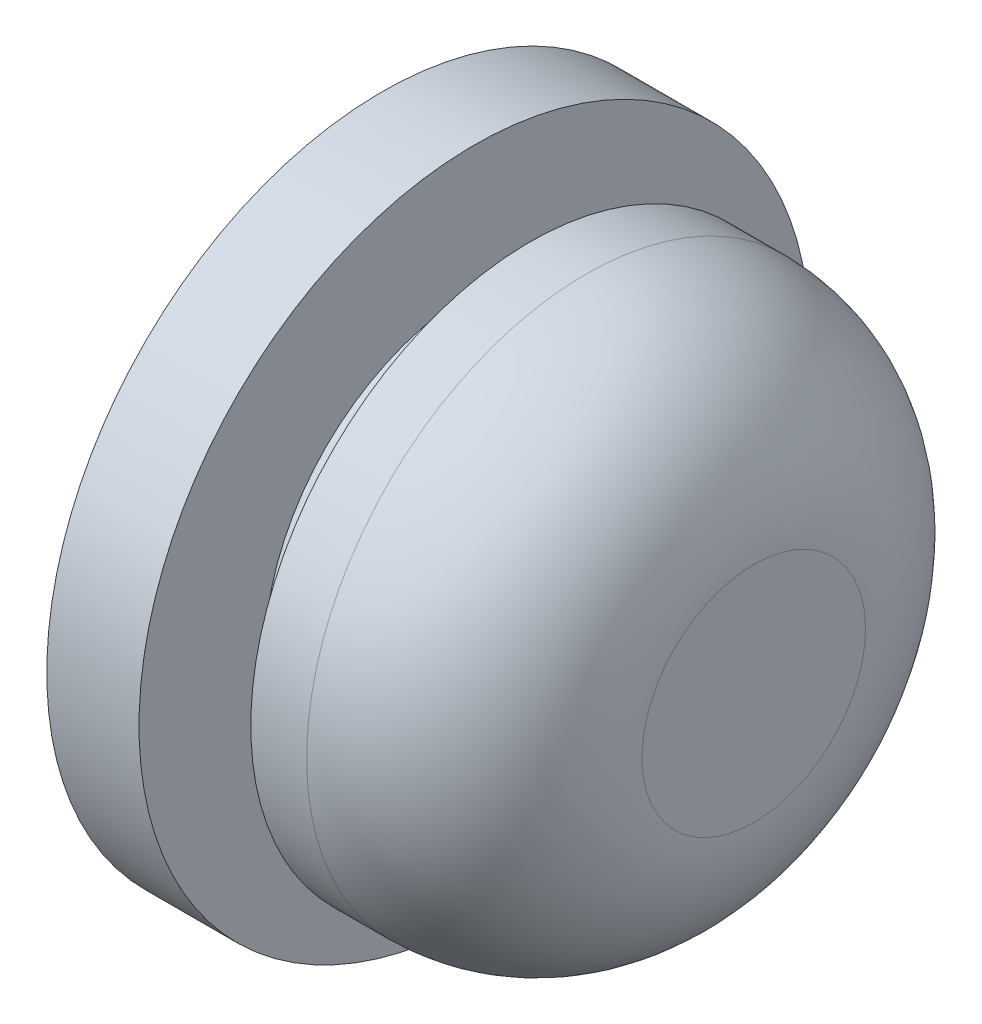
from build123d import *

# Parameters (mm, degrees)
SKETCH_2_R      = 12
SKETCH_2_R_2    = 4
EXTRUDE_1_DEPTH = 3.3
SKETCH_3_R      = 7.5
SKETCH_3_R_2    = 4
EXTRUDE_2_DEPTH = 2
SKETCH_4_R      = 10
EXTRUDE_3_DEPTH = 8
FILLET_1_R      = 6


with BuildPart() as part:
    # Эскиз2 → Бобышка-Вытянуть1 (new body)
    with BuildSketch(Plane(origin=(0, 0, 0), x_dir=(0, 0, -1), z_dir=(1, 0, 0))):
        Circle(SKETCH_2_R)
        Circle(SKETCH_2_R_2, mode=Mode.SUBTRACT)
    extrude(amount=EXTRUDE_1_DEPTH)

    # Эскиз3 → Бобышка-Вытянуть2 (add)
    with BuildSketch(Plane(origin=(3.3, 0, 0), x_dir=(0, 0, -1), z_dir=(1, 0, 0))):
        Circle(SKETCH_3_R)
        Circle(SKETCH_3_R_2, mode=Mode.SUBTRACT)
    extrude(amount=EXTRUDE_2_DEPTH)

    # Эскиз4 → Бобышка-Вытянуть3 (add)
    with BuildSketch(Plane(origin=(5.3, 0, 0), x_dir=(0, 0, -1), z_dir=(1, 0, 0))):
        Circle(SKETCH_4_R)
    extrude(amount=EXTRUDE_3_DEPTH)

    # Скругление1
    fillet_1_edges = [part.edges().sort_by_distance(p)[0] for p in [
        (13.3, 0, 10),
    ]]
    fillet(fillet_1_edges, radius=FILLET_1_R)


solid = part.part
